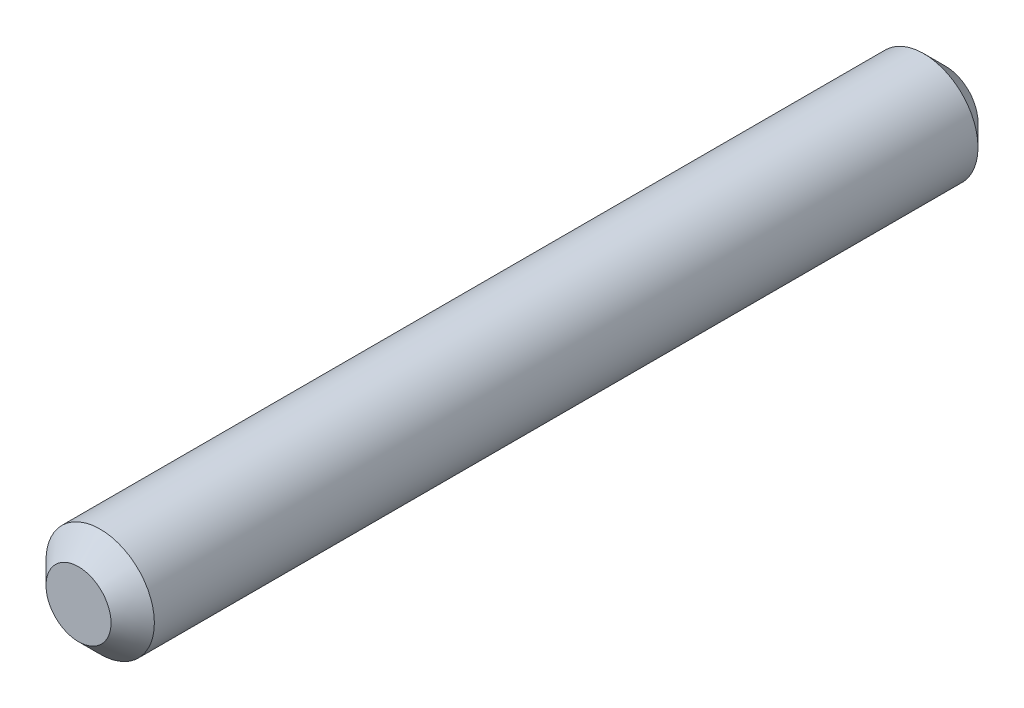
from build123d import *

# Parameters (mm, degrees)
SKETCH1_R           = 2.5
BOSS_EXTRUDE1_DEPTH = 40
CHAMFER1_SIZE       = 1


with BuildPart() as part:
    # Sketch1 → Boss-Extrude1 (new body)
    with BuildSketch(Plane.XY):
        Circle(SKETCH1_R)
    extrude(amount=BOSS_EXTRUDE1_DEPTH)

    # Chamfer1
    chamfer1_edges = [part.edges().sort_by_distance(p)[0] for p in [
        (-2.5, 0, 0),
        (-2.5, 0, 40),
    ]]
    chamfer(chamfer1_edges, length=CHAMFER1_SIZE)


solid = part.part
